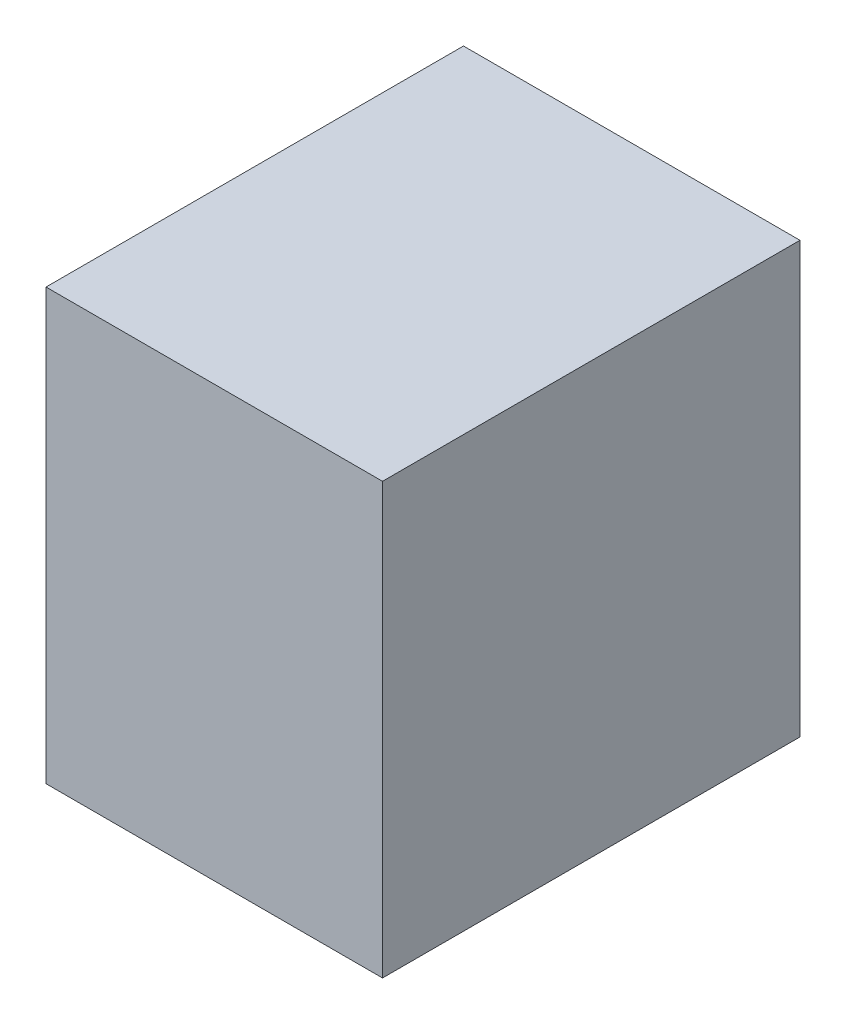
from build123d import *

# Parameters (mm, degrees)
SKETCH2_W           = 19.556231131
SKETCH2_H           = 24.262
BOSS_EXTRUDE1_DEPTH = 25


with BuildPart() as part:
    # Sketch2 → Boss-Extrude1 (new body)
    with BuildSketch(Plane(origin=(0, 0, 0), x_dir=(1, 0, 0), z_dir=(0, 1, 0))):
        with Locations((-31.284306498, -4.027693837)):
            Rectangle(SKETCH2_W, SKETCH2_H)
    extrude(amount=BOSS_EXTRUDE1_DEPTH)


solid = part.part
